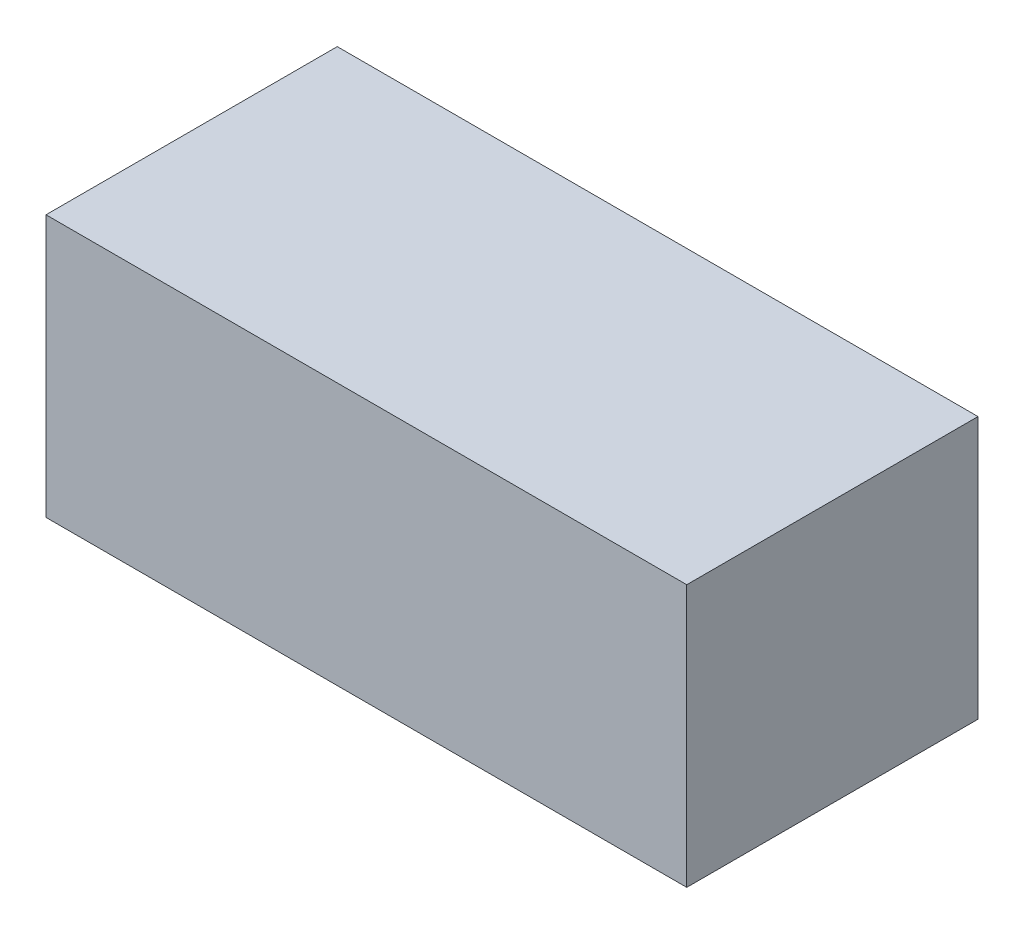
from build123d import *

# Parameters (mm, degrees)
SKETCH1_W           = 22
SKETCH1_H           = 10
BOSS_EXTRUDE1_DEPTH = 9


with BuildPart() as part:
    # Sketch1 → Boss-Extrude1 (new body)
    with BuildSketch(Plane(origin=(0, 0, 0), x_dir=(1, 0, 0), z_dir=(0, 1, 0))):
        Rectangle(SKETCH1_W, SKETCH1_H)
    extrude(amount=BOSS_EXTRUDE1_DEPTH)


solid = part.part
